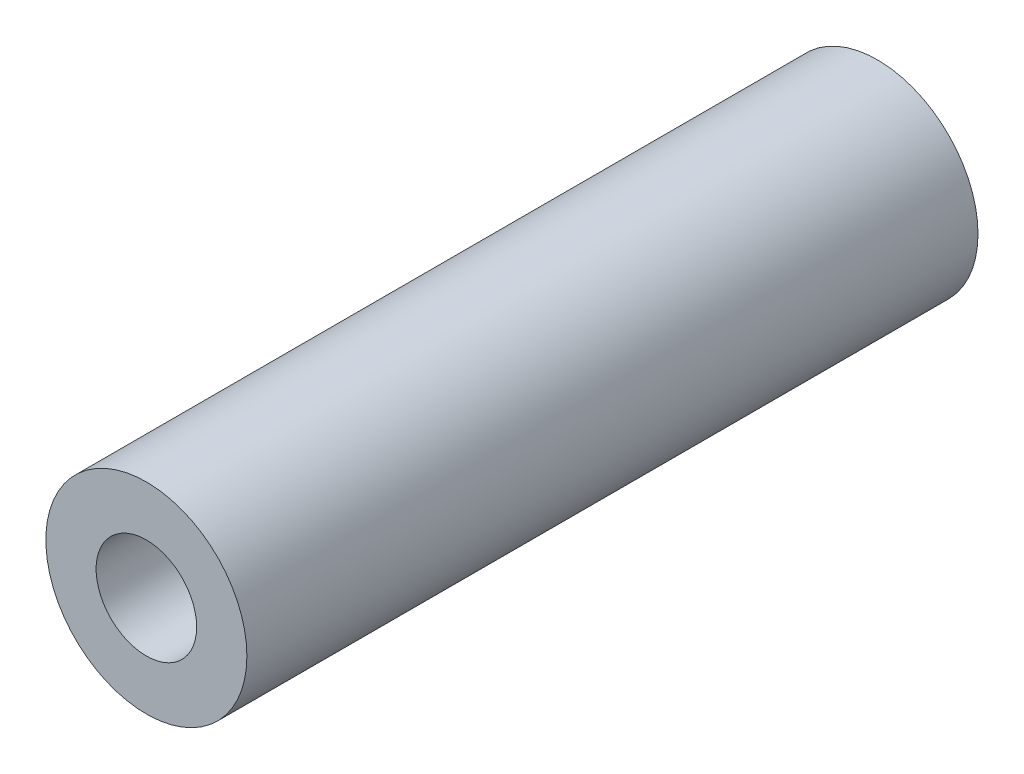
from build123d import *

# Parameters (mm, degrees)
SKETCH1_R           = 11
SKETCH1_R_2         = 5.5
BOSS_EXTRUDE1_DEPTH = 40


with BuildPart() as part:
    # Sketch1 → Boss-Extrude1 (new, symmetric)
    with BuildSketch(Plane.XY):
        Circle(SKETCH1_R)
        Circle(SKETCH1_R_2, mode=Mode.SUBTRACT)
    extrude(amount=BOSS_EXTRUDE1_DEPTH, both=True)


solid = part.part
